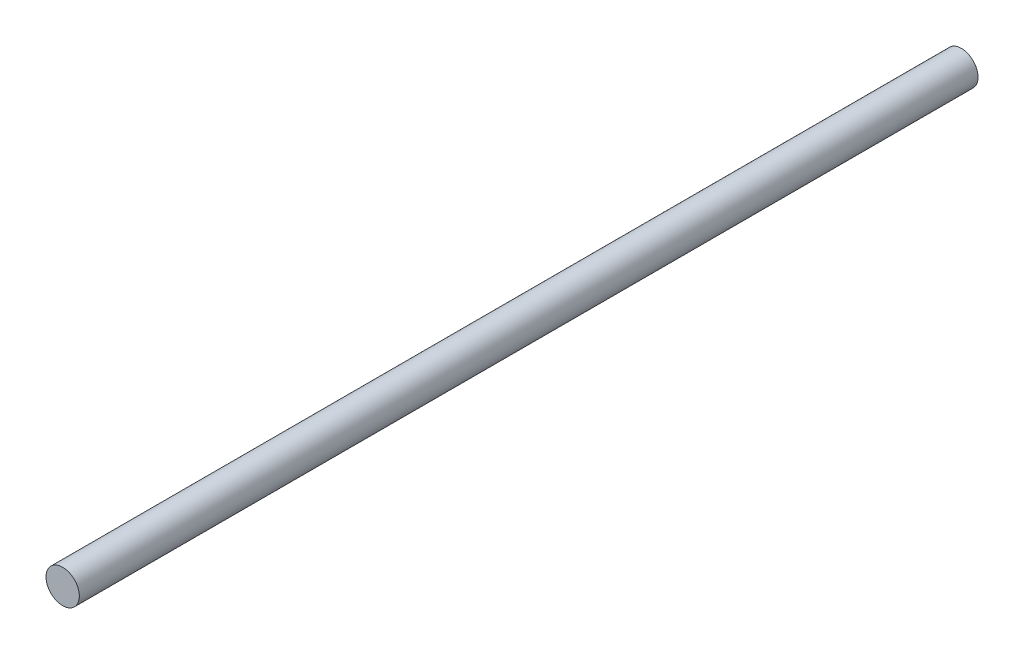
from build123d import *

# Parameters (mm, degrees)
SKETCH_1_R  = 3.8
CABLE_DEPTH = 205


with BuildPart() as part:
    # 草图1 → Cable (new body)
    with BuildSketch(Plane.XY):
        with Locations(Location((0, 0, 0), (0, 0, 180))):
            Circle(SKETCH_1_R)
    extrude(amount=CABLE_DEPTH)


solid = part.part
